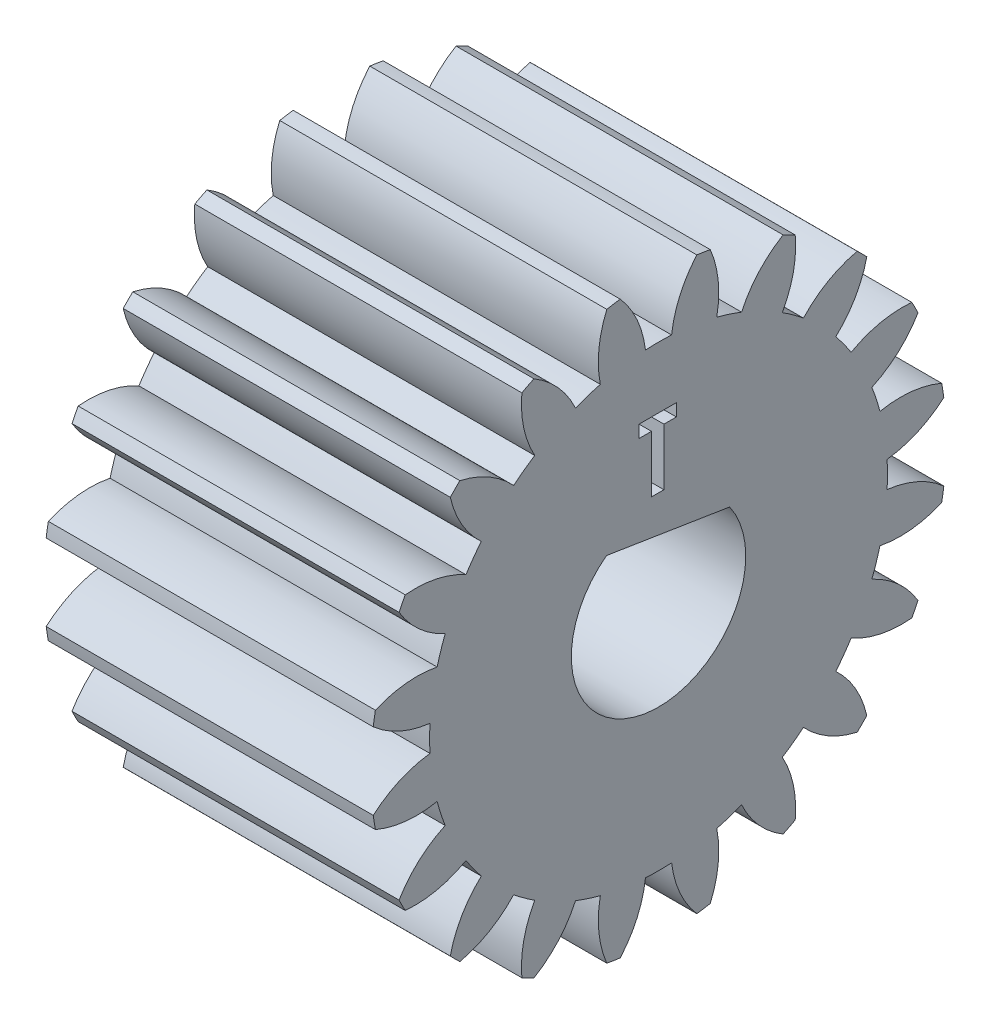
from build123d import *

# Parameters (mm, degrees)
BASPROSKE_W         = 15
BASPROSKE_H         = 13.2
TOOTHCUT_DEPTH      = 24.947442452
TEETHCUTS_COUNT     = 20
TEETHCUTS_ANGLE     = 342
BORSKE_R            = 4
BORE_DEPTH          = 50.0000508
BOSS_EXTRUDE1_START = -15
BOSS_EXTRUDE1_DEPTH = 15
SKETCH2_R           = 7.2
SKETCH2_R_2         = 6
CUT_EXTRUDE1_DEPTH  = 0.5
CUT_EXTRUDE2_DEPTH  = 2


with BuildPart() as part:
    # BasProSke → Base-Revolve (revolve)
    with BuildSketch(Plane(origin=(0, 0, 0), x_dir=(1, 0, 0), z_dir=(0, 1, 0)), mode=Mode.PRIVATE) as base_revolve_sk:
        with Locations((7.5, 6.6)):
            Rectangle(BASPROSKE_W, BASPROSKE_H)
    revolve(base_revolve_sk.sketch.rotate(Axis((-10, 0, 0), (1, 0, 0)), 180), axis=Axis((-10, 0, 0), (1, 0, 0)))

    # TooCutSke → ToothCut (cut, through all)
    with BuildSketch(Plane(origin=(0, 0, 0), x_dir=(0, 0, -1), z_dir=(1, 0, 0))):
        with BuildLine():
            ThreePointArc((0.599012827, 10.48189795), (0, 10.499), (-0.599012827, 10.48189795))
            ThreePointArc((-0.599012827, 10.48189795), (-0.986906343, 11.883983562), (-1.777012823, 13.105473306))
            ThreePointArc((-1.777012823, 13.105473306), (0, 13.2254), (1.777012823, 13.105473306))
            ThreePointArc((1.777012823, 13.105473306), (0.986906343, 11.883983562), (0.599012827, 10.48189795))
        make_face()
    toothcut = extrude(amount=TOOTHCUT_DEPTH, mode=Mode.SUBTRACT)

    # TeethCuts: ToothCut ×20 about axis
    teethcuts_axis = Axis((-10, 0, 0), (1, 0, 0))
    for i in range(1, TEETHCUTS_COUNT):
        add(toothcut.rotate(teethcuts_axis, i * TEETHCUTS_ANGLE / (TEETHCUTS_COUNT - 1)), mode=Mode.SUBTRACT)

    # BorSke → Bore (cut, symmetric)
    with BuildSketch(Plane(origin=(0, 0, 0), x_dir=(0, 0, -1), z_dir=(1, 0, 0))):
        with Locations(Location((0, 0, 0), (0, 0, 180))):
            Circle(BORSKE_R)
    extrude(amount=BORE_DEPTH, both=True, mode=Mode.SUBTRACT)

    # Sketch1 → Boss-Extrude1 (add)
    with BuildSketch(Plane.ZY.offset(BOSS_EXTRUDE1_START)):
        with BuildLine():
            Line((2.383385736, 3.212393568), (-3.25941874, 2.318661139))
            ThreePointArc((-3.25941874, 2.318661139), (-0.62573786, 3.950753362), (2.383385736, 3.212393568))
        make_face()
    extrude(amount=BOSS_EXTRUDE1_DEPTH)

    # Sketch2 → Cut-Extrude1 (cut)
    with BuildSketch(Plane.ZY):
        Circle(SKETCH2_R)
        Circle(SKETCH2_R_2, mode=Mode.SUBTRACT)
    extrude(amount=-CUT_EXTRUDE1_DEPTH, mode=Mode.SUBTRACT)

    # Sketch3 → Cut-Extrude2 (cut)
    with BuildSketch(Plane(origin=(15, 0, 0), x_dir=(0, 0, -1), z_dir=(1, 0, 0))):
        Polygon((-0.892330227, 7.685800395), (0.817285157, 7.685800395), (0.817285157, 7.1159286), (0.247413362, 7.1159286), (0.247413362, 4.510800395), (-0.322458432, 4.510800395), (-0.322458432, 7.1159286), (-0.892330227, 7.1159286), align=None)
    extrude(amount=-CUT_EXTRUDE2_DEPTH, mode=Mode.SUBTRACT)


solid = part.part
